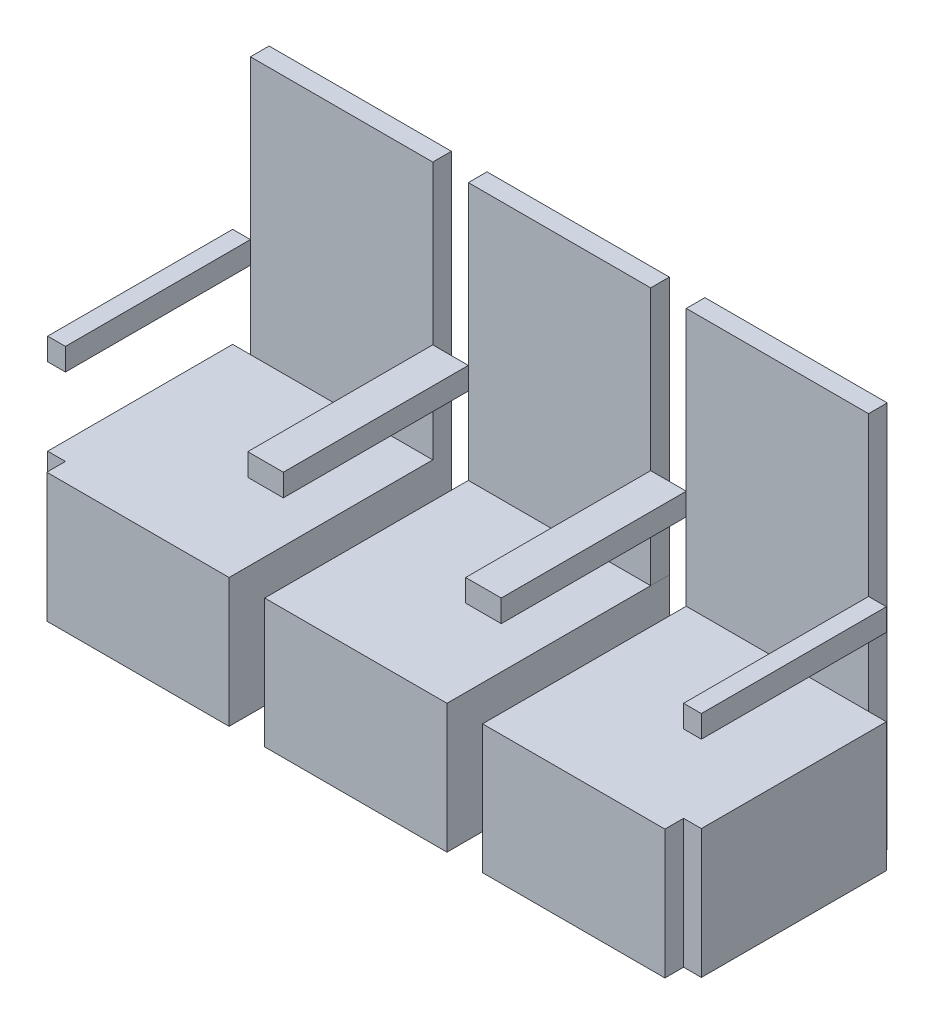
from build123d import *

# Parameters (mm, degrees)
BOSS_EXTRUDE1_DEPTH   = 368.3
BOSS_EXTRUDE1_2_DEPTH = 368.3
SKETCH1_W             = 520.7
SKETCH1_H             = 635
BOSS_EXTRUDE1_3_DEPTH = 368.3
SKETCH2_W             = 520.7
SKETCH2_H             = 53.34
BOSS_EXTRUDE2_DEPTH   = 736.6
SKETCH3_W             = 50.8
SKETCH3_H             = 63.5
BOSS_EXTRUDE3_DEPTH   = 528.32
BOSS_EXTRUDE3_2_DEPTH = 528.32
SKETCH3_W_2           = 101.6
BOSS_EXTRUDE3_3_DEPTH = 528.32
BOSS_EXTRUDE3_4_DEPTH = 528.32


with BuildPart() as part:
    # Sketch1 → Boss-Extrude1 (new body)
    with BuildSketch(Plane(origin=(0, 0, 0), x_dir=(1, 0, 0), z_dir=(0, 1, 0))):
        Polygon((-933.45, 264.16), (-882.65, 264.16), (-882.65, 317.5), (-361.95, 317.5), (-361.95, -317.5), (-882.65, -317.5), (-882.65, -264.16), (-933.45, -264.16), align=None)
    extrude(amount=BOSS_EXTRUDE1_DEPTH)



with BuildPart() as body_2:
    # Sketch1 → Boss-Extrude1 2 (new body)
    with BuildSketch(Plane(origin=(0, 0, 0), x_dir=(1, 0, 0), z_dir=(0, 1, 0))):
        Polygon((361.95, -317.5), (882.65, -317.5), (882.65, -264.16), (933.45, -264.16), (933.45, 264.16), (882.65, 264.16), (882.65, 317.5), (361.95, 317.5), align=None)
    extrude(amount=BOSS_EXTRUDE1_2_DEPTH)


with BuildPart() as body_3:
    # Sketch1 → Boss-Extrude1 3 (new body)
    with BuildSketch(Plane(origin=(0, 0, 0), x_dir=(1, 0, 0), z_dir=(0, 1, 0))):
        Rectangle(SKETCH1_W, SKETCH1_H)
    extrude(amount=BOSS_EXTRUDE1_3_DEPTH)


with BuildPart() as part_1:
    add(part.part)

    add(body_2.part)  # Boss-Extrude2 merges body 2
    # Sketch2 → Boss-Extrude2 (add)
    with BuildSketch(Plane(origin=(0, 368.3, 0), x_dir=(1, 0, 0), z_dir=(0, 1, 0))):
        with Locations((-622.3, 290.83)):
            Rectangle(SKETCH2_W, SKETCH2_H)
        with Locations((622.3, 290.83)):
            Rectangle(SKETCH2_W, SKETCH2_H)
        with Locations((0, 290.83)):
            Rectangle(SKETCH2_W, SKETCH2_H)
    extrude(amount=BOSS_EXTRUDE2_DEPTH)


with BuildPart() as body_3_2:
    # Sketch3 → Boss-Extrude3 (new body)
    with BuildSketch(Plane.XY.offset(-264.16)):
        with Locations((-908.05, 621.03)):
            Rectangle(SKETCH3_W, SKETCH3_H)
    extrude(amount=BOSS_EXTRUDE3_DEPTH)


with BuildPart() as body_4:
    # Sketch3 → Boss-Extrude3 2 (new body)
    with BuildSketch(Plane.XY.offset(-264.16)):
        with Locations((908.05, 621.03)):
            Rectangle(SKETCH3_W, SKETCH3_H)
    extrude(amount=BOSS_EXTRUDE3_2_DEPTH)


with BuildPart() as body_5:
    # Sketch3 → Boss-Extrude3 3 (new body)
    with BuildSketch(Plane.XY.offset(-264.16)):
        with Locations((-311.15, 621.03)):
            Rectangle(SKETCH3_W_2, SKETCH3_H)
    extrude(amount=BOSS_EXTRUDE3_3_DEPTH)


with BuildPart() as body_6:
    # Sketch3 → Boss-Extrude3 4 (new body)
    with BuildSketch(Plane.XY.offset(-264.16)):
        with Locations((311.15, 621.03)):
            Rectangle(SKETCH3_W_2, SKETCH3_H)
    extrude(amount=BOSS_EXTRUDE3_4_DEPTH)


solid = Compound([body_3.part, part_1.part, body_3_2.part, body_4.part, body_5.part, body_6.part])
